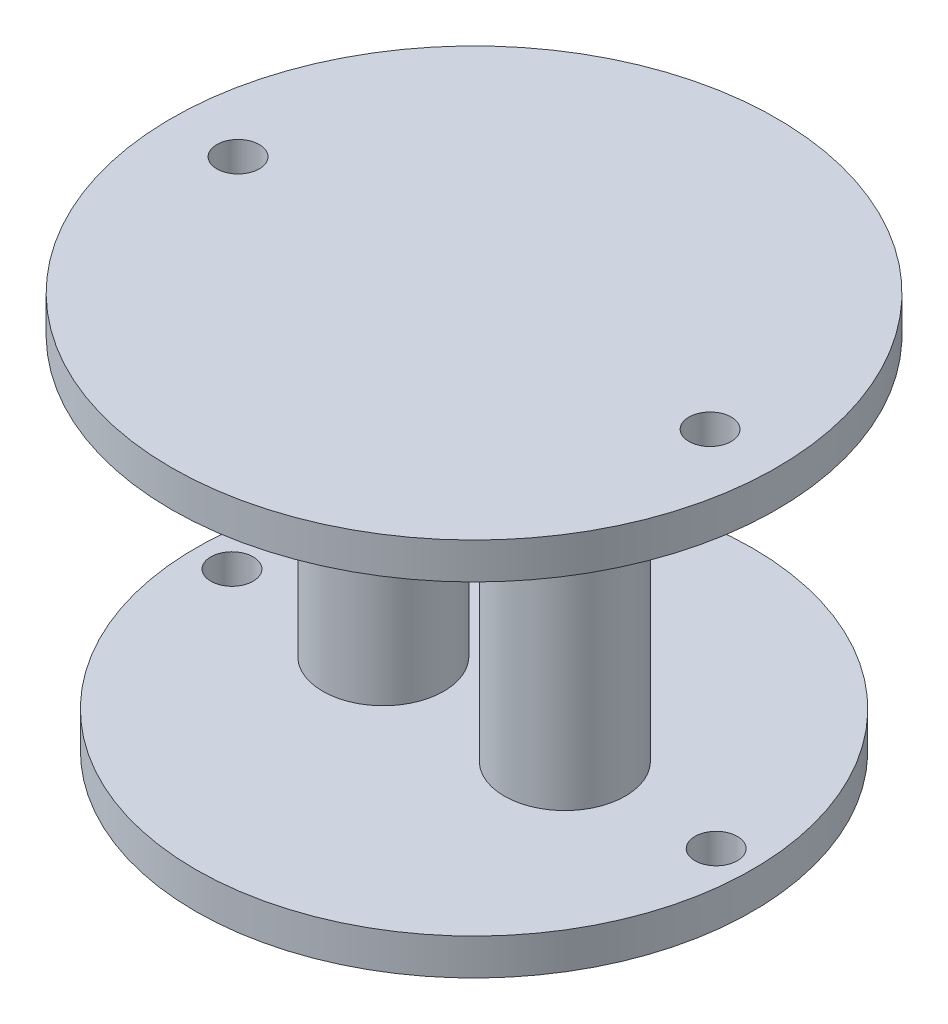
from build123d import *

# Parameters (mm, degrees)
SKETCH_1_R      = 23
SKETCH_1_R_2    = 1.75
SKETCH_1_R_3    = 5
EXTRUDE_1_DEPTH = 3
SKETCH_1_3_R    = 5
EXTRUDE_2_DEPTH = 32.75
SKETCH_2_R      = 25
SKETCH_2_R_2    = 1.75
EXTRUDE_3_DEPTH = 3


with BuildPart() as part:
    # 草图1 → 凸台-拉伸1 (new body)
    with BuildSketch(Plane(origin=(0, 0, 0), x_dir=(1, 0, 0), z_dir=(0, 1, 0))):
        with Locations(Location((7.5, 0, 0), (0, 0, 270))):
            Circle(SKETCH_1_R)
        with Locations(Location((27.5, 0, 0), (0, 0, 270))):
            Circle(SKETCH_1_R_2, mode=Mode.SUBTRACT)
        with Locations(Location((-12.5, 0, 0), (0, 0, 270))):
            Circle(SKETCH_1_R_2, mode=Mode.SUBTRACT)
        with Locations(Location((0, 0, 0), (0, 0, 270))):
            Circle(SKETCH_1_R_3, mode=Mode.SUBTRACT)
        with Locations(Location((15, 0, 0), (0, 0, 270))):
            Circle(SKETCH_1_R_3, mode=Mode.SUBTRACT)
    extrude(amount=EXTRUDE_1_DEPTH)

    # 草图1<3> → 凸台-拉伸2 (add)
    with BuildSketch(Plane(origin=(0, 0, 0), x_dir=(1, 0, 0), z_dir=(0, 1, 0))):
        with Locations(Location((0, 0, 0), (0, 0, 270))):
            Circle(SKETCH_1_3_R)
        with Locations(Location((15, 0, 0), (0, 0, 270))):
            Circle(SKETCH_1_3_R)
    extrude(amount=EXTRUDE_2_DEPTH)

    # 草图2 → 凸台-拉伸3 (add)
    with BuildSketch(Plane(origin=(0, 32.75, 0), x_dir=(1, 0, 0), z_dir=(0, 1, 0))):
        with Locations(Location((7.5, 0, 0), (0, 0, 270))):
            Circle(SKETCH_2_R)
        with Locations(Location((-12, 0, 0), (0, 0, 270))):
            Circle(SKETCH_2_R_2, mode=Mode.SUBTRACT)
        with Locations(Location((27, 0, 0), (0, 0, 270))):
            Circle(SKETCH_2_R_2, mode=Mode.SUBTRACT)
    extrude(amount=-EXTRUDE_3_DEPTH)


solid = part.part
